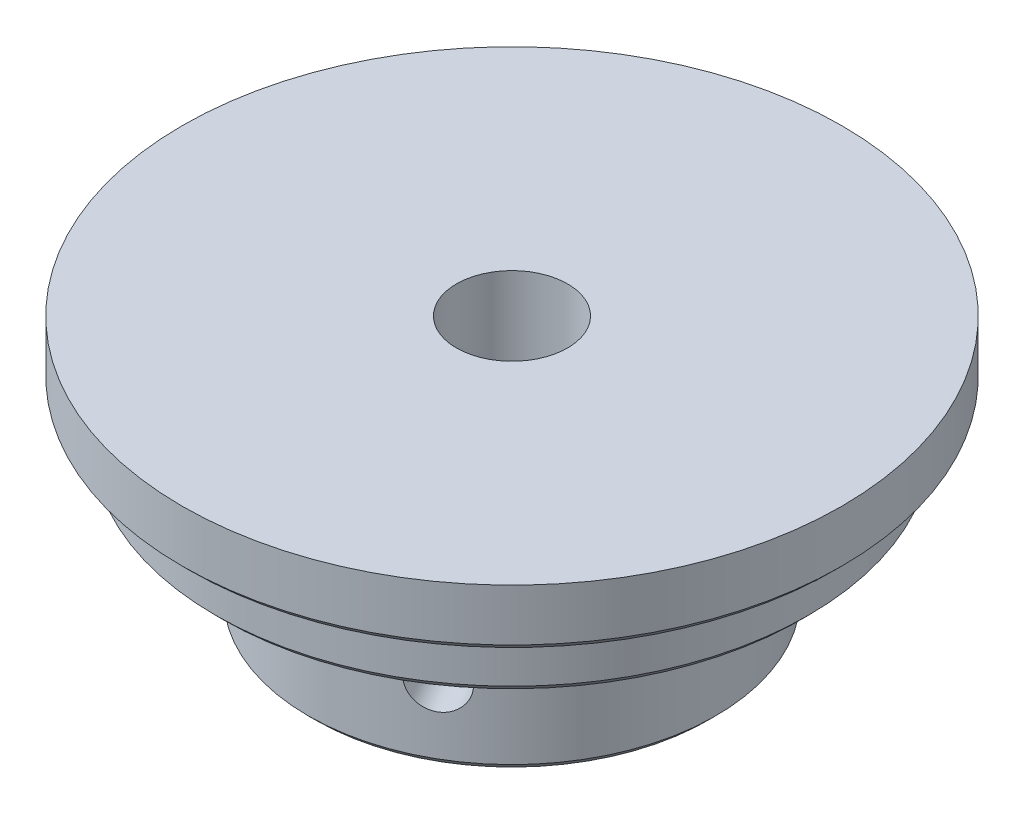
from build123d import *

# Parameters (mm, degrees)
FORO_15_0_15_1_D               = 15
FORO_11_0_11_2_D               = 11
FORO_11_0_11_2_DEPTH           = 27.5
FORO_11_0_11_2_ON_FACE_2_D     = 11
FORO_11_0_11_2_ON_FACE_2_DEPTH = 27.5
FORO_7_0_7_1_D                 = 7
FORO_7_0_7_1_DEPTH             = 27.5
SMUSSO1_SIZE                   = 1


with BuildPart() as part:
    # Schizzo2 → Rivoluzione2 (revolve)
    with BuildSketch(Plane.XY, mode=Mode.PRIVATE) as rivoluzione2_sk:
        Polygon((0, 0), (0, -34), (27.5, -34), (27.5, -16), (40, -16), (40, -8), (44.5, -8), (44.5, 0), align=None)
    revolve(rivoluzione2_sk.sketch.rotate(Axis((0, 0, 0), (0, -1, 0)), 90), axis=Axis((0, 0, 0), (0, -1, 0)))

    # Foro Ø15.0 (15)-1 (through all)
    with Locations(Plane.ZX):
        with Locations((0, 0)):
            Hole(FORO_15_0_15_1_D / 2)

    # Foro Ø11.0 (11)-2
    with Locations(Plane(origin=(-27.499989687, -24.000114667, -0.023815764), x_dir=(0.00086602778, 0, -0.999999624998), z_dir=(-0.999999624998, 0, -0.00086602778))):
        with Locations((0, 0)):
            Hole(FORO_11_0_11_2_D / 2, depth=FORO_11_0_11_2_DEPTH)

    # Foro Ø11.0 (11)-2 on face 2
    with Locations(Plane(origin=(-27.461073612, -24.000080572, -0.023731809), x_dir=(0.00086602778, 0, -0.999999624998), z_dir=(-0.999999624998, 0, -0.00086602778))):
        with Locations((0, 0)):
            Hole(FORO_11_0_11_2_ON_FACE_2_D / 2, depth=FORO_11_0_11_2_ON_FACE_2_DEPTH)

    # Foro Ø7.0 (7)-1
    with Locations(Plane(origin=(13.75, -24, 23.815698604), x_dir=(0.866025403784, 0, -0.5), z_dir=(0.5, 0, 0.866025403784))):
        with Locations((0, 0)):
            foro_7_0_7_1 = Hole(FORO_7_0_7_1_D / 2, depth=FORO_7_0_7_1_DEPTH)

    # Specchia1: Foro Ø7.0 (7)-1 across plane
    add(foro_7_0_7_1.mirror(Plane.XY), mode=Mode.SUBTRACT)

    # Smusso1
    smusso1_edges = [part.edges().sort_by_distance(p)[0] for p in [
        (0, -8, -44.5),
        (0, -16, -40),
        (0, -34, -27.5),
    ]]
    chamfer(smusso1_edges, length=SMUSSO1_SIZE)


solid = part.part
